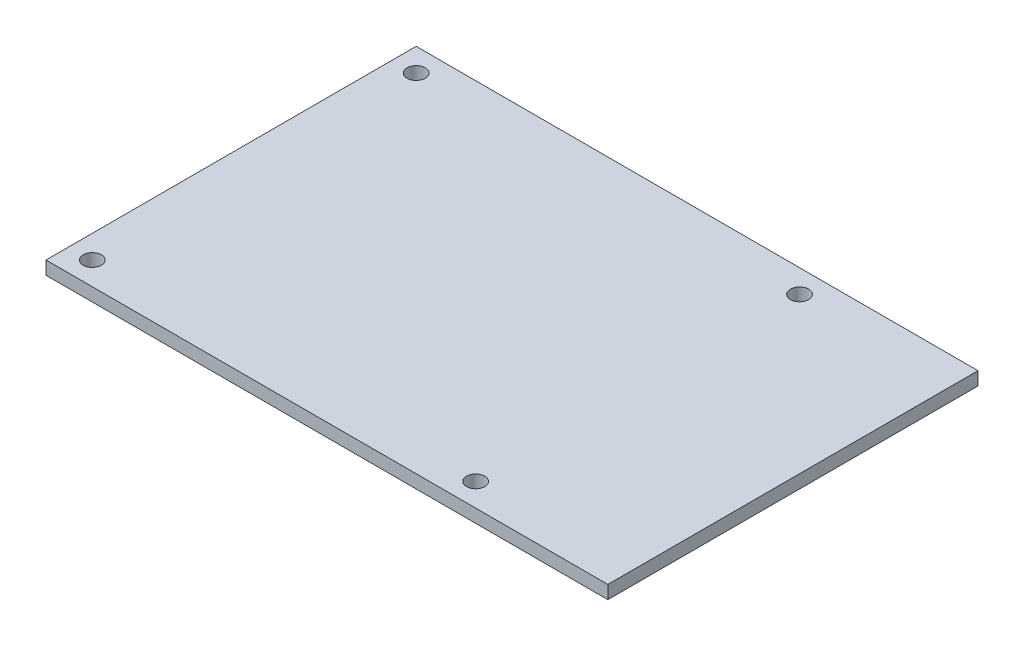
from build123d import *

# Parameters (mm, degrees)
ESBO_O1_W                = 85
ESBO_O1_H                = 56
ESBO_O1_R                = 1.375
RESSALTO_EXTRUS_O1_DEPTH = 2


with BuildPart() as part:
    # Esboço1 → Ressalto-extrusão1 (new body)
    with BuildSketch(Plane(origin=(0, 0, 0), x_dir=(1, 0, 0), z_dir=(0, 1, 0))):
        Rectangle(ESBO_O1_W, ESBO_O1_H)
        with Locations(Location((-39, -24.5, 0), (0, 0, 270))):
            Circle(ESBO_O1_R, mode=Mode.SUBTRACT)
        with Locations(Location((-39, 24.5, 0), (0, 0, 270))):
            Circle(ESBO_O1_R, mode=Mode.SUBTRACT)
        with Locations(Location((19, -24.5, 0), (0, 0, 270))):
            Circle(ESBO_O1_R, mode=Mode.SUBTRACT)
        with Locations(Location((19, 24.5, 0), (0, 0, 270))):
            Circle(ESBO_O1_R, mode=Mode.SUBTRACT)
    extrude(amount=RESSALTO_EXTRUS_O1_DEPTH)


solid = part.part
